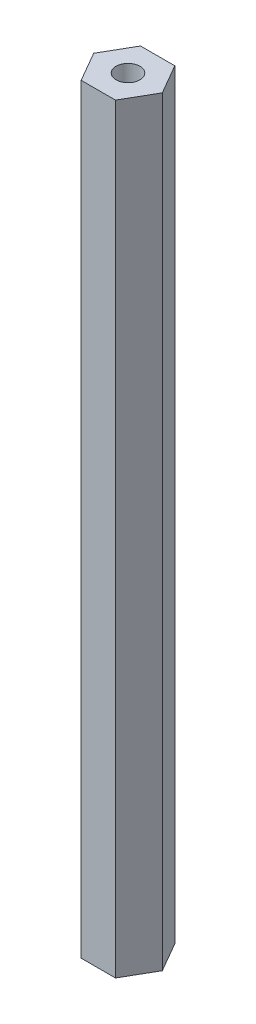
from build123d import *

# Parameters (mm, degrees)
SKETCH_1_R      = 1
EXTRUDE_1_DEPTH = 64


with BuildPart() as part:
    # 草图1 → 凸台-拉伸1 (new body)
    with BuildSketch(Plane(origin=(0, 0, 0), x_dir=(1, 0, 0), z_dir=(0, 1, 0))):
        Polygon((2.886751346, 0), (1.443375673, 2.5), (-1.443375673, 2.5), (-2.886751346, 0), (-1.443375673, -2.5), (1.443375673, -2.5), align=None)
        with Locations(Location((0, 0, 0), (0, 0, 270))):
            Circle(SKETCH_1_R, mode=Mode.SUBTRACT)
    extrude(amount=EXTRUDE_1_DEPTH)


solid = part.part
